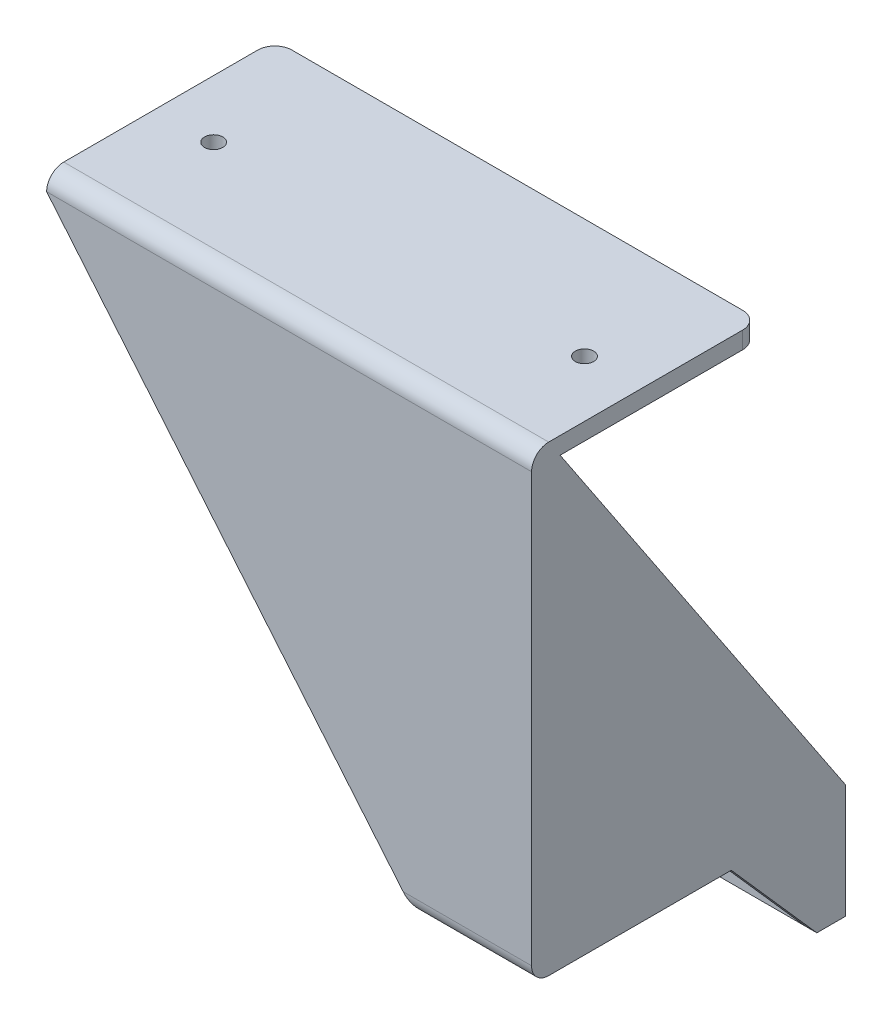
from build123d import *

# Parameters (mm, degrees)
SKETCH1_W            = 20
SKETCH1_H            = 20
BOSS_EXTRUDE1_DEPTH  = 5
SKETCH2_W            = 20
SKETCH2_H            = 3
BOSS_EXTRUDE2_DEPTH  = 20
BOSS_EXTRUDE3_DEPTH  = 2
BOSS_EXTRUDE4_DEPTH  = 2
SKETCH5_R            = 2.6
CUT_EXTRUDE1_DEPTH   = 21.615528128
SKETCH6_W            = 20
SKETCH6_H            = 3
BOSS_EXTRUDE5_DEPTH  = 5
SKETCH17_W           = 30
SKETCH17_H           = 3
BOSS_EXTRUDE14_DEPTH = 20
SKETCH18_W           = 13
SKETCH18_H           = 78
BOSS_EXTRUDE17_DEPTH = 20
SKETCH20_W           = 10
SKETCH20_H           = 78
CUT_EXTRUDE3_DEPTH   = 106.683489723
BOSS_EXTRUDE20_DEPTH = 2
SKETCH24_W           = 20
SKETCH24_H           = 3
BOSS_EXTRUDE21_DEPTH = 42
SKETCH25_W           = 45
SKETCH25_H           = 3
BOSS_EXTRUDE22_DEPTH = 65
SKETCH26_W           = 85
SKETCH26_H           = 5
CUT_EXTRUDE4_DEPTH   = 28
BOSS_EXTRUDE24_DEPTH = 3
SKETCH28_R           = 1.6
CUT_EXTRUDE6_DEPTH   = 7
FILLET4_R            = 3
FILLET5_R            = 3


with BuildPart() as part:
    # Sketch1 → Boss-Extrude1 (new body)
    with BuildSketch(Plane.XY):
        Rectangle(SKETCH1_W, SKETCH1_H)
    extrude(amount=BOSS_EXTRUDE1_DEPTH)

    # Sketch2 → Boss-Extrude2 (add)
    with BuildSketch(Plane.XY):
        with Locations((0, 8.5)):
            Rectangle(SKETCH2_W, SKETCH2_H)
    extrude(amount=BOSS_EXTRUDE2_DEPTH)

    # Sketch3 → Boss-Extrude3 (add)
    with BuildSketch(Plane.ZY.offset(10)):
        Polygon((20, 7), (5, -10), (5, 7), align=None)
    extrude(amount=-BOSS_EXTRUDE3_DEPTH)

    # Sketch4 → Boss-Extrude4 (add)
    with BuildSketch(Plane(origin=(10, 0, 0), x_dir=(0, 0, -1), z_dir=(1, 0, 0))):
        Polygon((-20, 7), (-5, -10), (-5, 7), align=None)
    extrude(amount=-BOSS_EXTRUDE4_DEPTH)

    # Sketch5 → Cut-Extrude1 (cut, through all)
    with BuildSketch(Plane.XY.offset(5)):
        with Locations((0, -1.5)):
            Circle(SKETCH5_R)
    extrude(amount=-CUT_EXTRUDE1_DEPTH, mode=Mode.SUBTRACT)

    # Sketch6 → Boss-Extrude5 (add)
    with BuildSketch(Plane.XY.offset(20)):
        with Locations((0, 8.5)):
            Rectangle(SKETCH6_W, SKETCH6_H)
    extrude(amount=BOSS_EXTRUDE5_DEPTH)

    # Sketch17 → Boss-Extrude14 (add)
    with BuildSketch(Plane(origin=(10, 0, 0), x_dir=(0, 0, -1), z_dir=(1, 0, 0))):
        with Locations((-40, 8.5)):
            Rectangle(SKETCH17_W, SKETCH17_H)
    extrude(amount=-BOSS_EXTRUDE14_DEPTH)

    # Sketch18 → Boss-Extrude17 (add)
    with BuildSketch(Plane(origin=(10, 0, 0), x_dir=(0, 0, -1), z_dir=(1, 0, 0))):
        with Locations((-48.5, 49)):
            Rectangle(SKETCH18_W, SKETCH18_H)
    extrude(amount=-BOSS_EXTRUDE17_DEPTH)

    # Sketch20 → Cut-Extrude3 (cut, through all)
    with BuildSketch(Plane(origin=(10, 0, 0), x_dir=(0, 0, -1), z_dir=(1, 0, 0))):
        with Locations((-47, 49)):
            Rectangle(SKETCH20_W, SKETCH20_H)
    extrude(amount=-CUT_EXTRUDE3_DEPTH, mode=Mode.SUBTRACT)

    # Sketch23 → Boss-Extrude20 (add)
    with BuildSketch(Plane(origin=(10, 0, 0), x_dir=(0, 0, -1), z_dir=(1, 0, 0))):
        Polygon((-52, 88), (0, 10), (-52, 10), align=None)
    extrude(amount=-BOSS_EXTRUDE20_DEPTH)

    # Sketch24 → Boss-Extrude21 (add)
    with BuildSketch(Plane(origin=(0, 0, 52), x_dir=(-1, 0, 0), z_dir=(0, 0, -1))):
        with Locations((0, 86.5)):
            Rectangle(SKETCH24_W, SKETCH24_H)
    extrude(amount=BOSS_EXTRUDE21_DEPTH)

    # Sketch25 → Boss-Extrude22 (add)
    with BuildSketch(Plane.ZY.offset(10)):
        with Locations((32.5, 86.5)):
            Rectangle(SKETCH25_W, SKETCH25_H)
    extrude(amount=BOSS_EXTRUDE22_DEPTH)

    # Sketch26 → Cut-Extrude4 (cut)
    with BuildSketch(Plane(origin=(0, 88, 0), x_dir=(1, 0, 0), z_dir=(0, 1, 0))):
        with Locations((-32.5, -12.5)):
            Rectangle(SKETCH26_W, SKETCH26_H)
    extrude(amount=-CUT_EXTRUDE4_DEPTH, mode=Mode.SUBTRACT)

    # Sketch27 → Boss-Extrude24 (add)
    with BuildSketch(Plane.XY.offset(55)):
        Polygon((-75, 85), (-10, 7), (-10, 85), align=None)
    extrude(amount=-BOSS_EXTRUDE24_DEPTH)

    # Sketch28 → Cut-Extrude6 (cut)
    with BuildSketch(Plane(origin=(0, 88, 0), x_dir=(1, 0, 0), z_dir=(0, 1, 0))):
        with Locations(Location((0.120495814, -35.846198104, 0), (0, 0, 270))):
            Circle(SKETCH28_R)
        with Locations(Location((-64.879504186, -35.846198104, 0), (0, 0, 270))):
            Circle(SKETCH28_R)
    extrude(amount=-CUT_EXTRUDE6_DEPTH, mode=Mode.SUBTRACT)

    # Fillet4
    fillet4_edges = [part.edges().sort_by_distance(p)[0] for p in [
        (-75, 86.5, 15),
        (10, 86.5, 15),
    ]]
    fillet(fillet4_edges, radius=FILLET4_R)

    # Fillet5
    fillet5_edges = [part.edges().sort_by_distance(p)[0] for p in [
        (0, 7, 55),
        (-32.5, 88, 55),
    ]]
    fillet(fillet5_edges, radius=FILLET5_R)


solid = part.part
